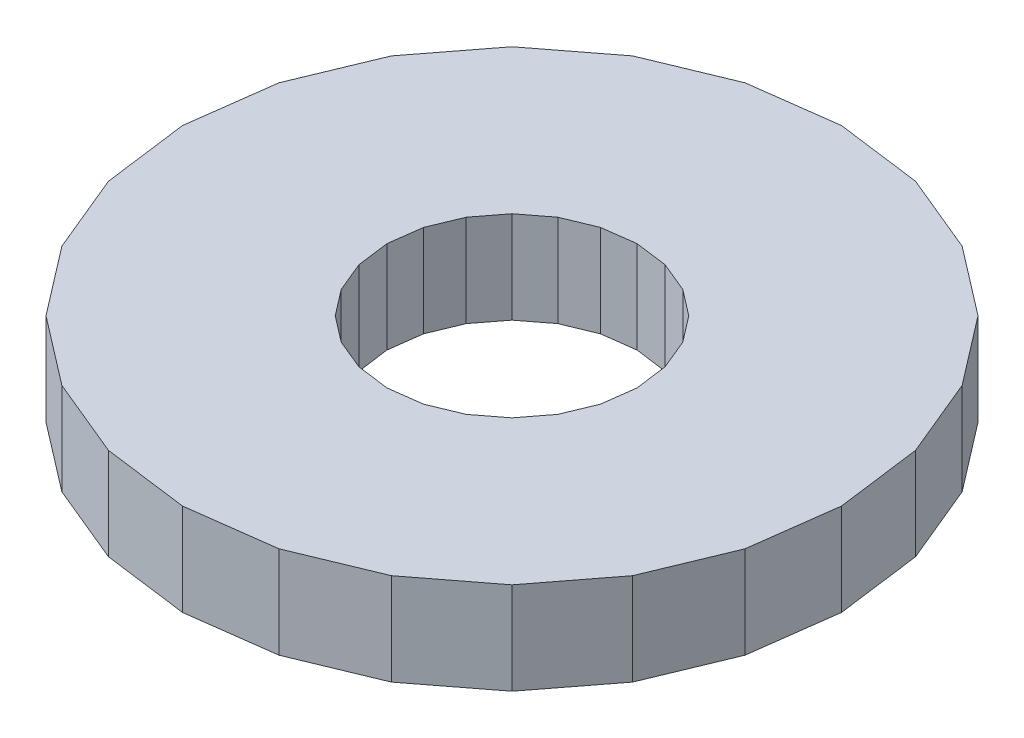
from build123d import *

# Parameters (mm, degrees)
BOSS_EXTRUDE3_DEPTH = 19.05


with BuildPart() as part:
    # Sketch3 → Boss-Extrude3 (new body)
    with BuildSketch(Plane(origin=(0, 0, 0), x_dir=(1, 0, 0), z_dir=(0, 1, 0))):
        Polygon((-68.108935447, 0), (-65.788179749, -17.627889635), (-58.984068321, -34.054467723), (-48.160290114, -48.160290114), (-34.054467723, -58.984068321), (-17.627889635, -65.788179749), (0, -68.108935447), (17.627889635, -65.788179749), (34.054467723, -58.984068321), (48.160290114, -48.160290114), (58.984068321, -34.054467723), (65.788179749, -17.627889635), (68.108935447, 0), (65.788179749, 17.627889635), (58.984068321, 34.054467723), (48.160290114, 48.160290114), (34.054467723, 58.984068321), (17.627889635, 65.788179749), (0, 68.108935447), (-17.627889635, 65.788179749), (-34.054467723, 58.984068321), (-48.160290114, 48.160290114), (-58.984068321, 34.054467723), (-65.788179749, 17.627889635), align=None)
        Polygon((-25.837295709, 0), (-24.956911206, -6.687184203), (-22.375754449, -12.918647854), (-18.269727003, -18.269727003), (-12.918647854, -22.375754449), (-6.687184203, -24.956911206), (0, -25.837295709), (6.687184203, -24.956911206), (12.918647854, -22.375754449), (18.269727003, -18.269727003), (22.375754449, -12.918647854), (24.956911206, -6.687184203), (25.837295709, 0), (24.956911206, 6.687184203), (22.375754449, 12.918647854), (18.269727003, 18.269727003), (12.918647854, 22.375754449), (6.687184203, 24.956911206), (0, 25.837295709), (-6.687184203, 24.956911206), (-12.918647854, 22.375754449), (-18.269727003, 18.269727003), (-22.375754449, 12.918647854), (-24.956911206, 6.687184203), align=None, mode=Mode.SUBTRACT)
    extrude(amount=BOSS_EXTRUDE3_DEPTH)


solid = part.part
